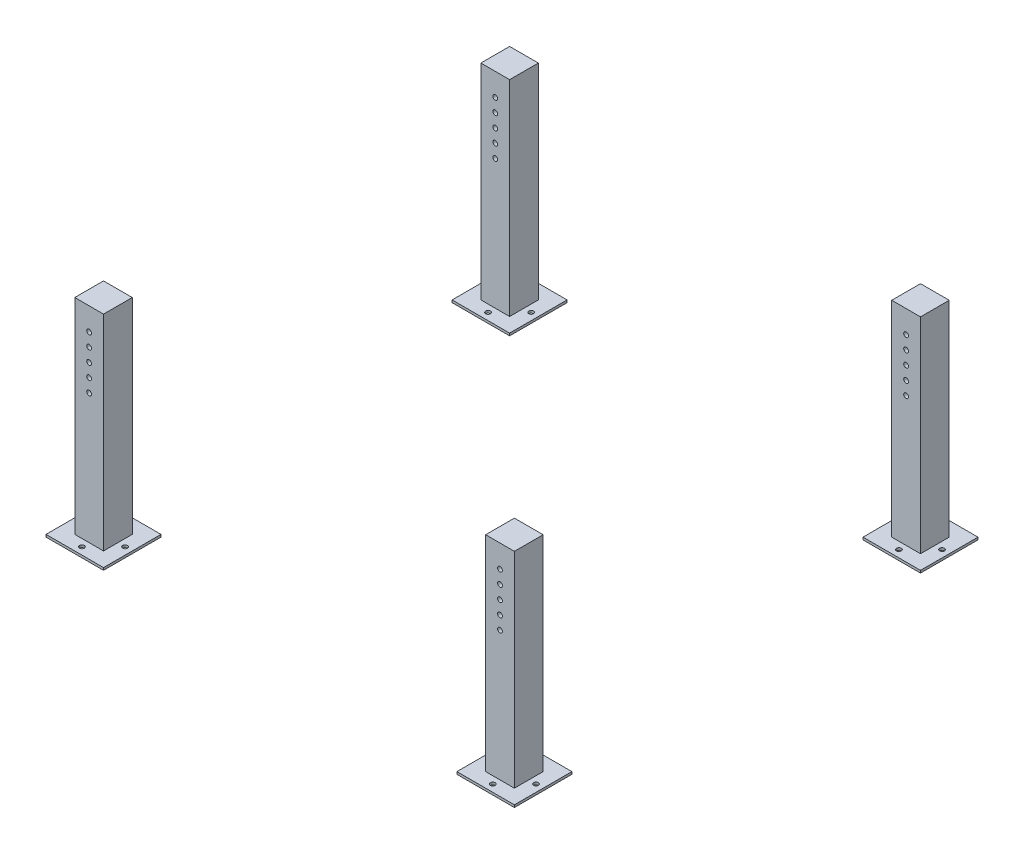
from build123d import *

# Parameters (mm, degrees)
CROQUIS1_W                = 76.2
CROQUIS1_H                = 76.2
SALIENTE_EXTRUIR1_DEPTH   = 550
SALIENTE_EXTRUIR1_2_DEPTH = 550
SALIENTE_EXTRUIR1_3_DEPTH = 550
SALIENTE_EXTRUIR1_4_DEPTH = 550
CROQUIS2_W                = 152.4
CROQUIS2_H                = 152.4
CROQUIS2_W_2              = 76.2
CROQUIS2_H_2              = 76.2
SALIENTE_EXTRUIR2_DEPTH   = 6.35
CROQUIS3_R                = 6.35
CORTAR_EXTRUIR1_DEPTH     = 6.35
CROQUIS4_R                = 6.35
CORTAR_EXTRUIR2_DEPTH     = 6.35
CROQUIS5_R                = 6.35
CORTAR_EXTRUIR3_DEPTH     = 6.35
CROQUIS6_R                = 6.35
CORTAR_EXTRUIR4_DEPTH     = 6.35
CROQUIS7_R                = 6.35
CORTAR_EXTRUIR5_DEPTH     = 76.2
CROQUIS8_R                = 6.35
CORTAR_EXTRUIR6_DEPTH     = 76.2
CORTAR_EXTRUIR7_START     = -76.2
CROQUIS9_R                = 6.35
CORTAR_EXTRUIR7_DEPTH     = 76.2
CORTAR_EXTRUIR8_START     = -76.2
CROQUIS10_R               = 6.35
CORTAR_EXTRUIR8_DEPTH     = 76.2


with BuildPart() as part:
    # Croquis1 → Saliente-Extruir1 (new body)
    with BuildSketch(Plane(origin=(0, 0, 0), x_dir=(1, 0, 0), z_dir=(0, 1, 0))):
        with Locations((38.1, -38.1)):
            Rectangle(CROQUIS1_W, CROQUIS1_H)
    extrude(amount=SALIENTE_EXTRUIR1_DEPTH)



with BuildPart() as body_2:
    # Croquis1 → Saliente-Extruir1 2 (new body)
    with BuildSketch(Plane(origin=(0, 0, 0), x_dir=(1, 0, 0), z_dir=(0, 1, 0))):
        with Locations((1126.97, -38.1)):
            Rectangle(CROQUIS1_W, CROQUIS1_H)
    extrude(amount=SALIENTE_EXTRUIR1_2_DEPTH)


with BuildPart() as body_3:
    # Croquis1 → Saliente-Extruir1 3 (new body)
    with BuildSketch(Plane(origin=(0, 0, 0), x_dir=(1, 0, 0), z_dir=(0, 1, 0))):
        with Locations((1126.97, -1114.3)):
            Rectangle(CROQUIS1_W, CROQUIS1_H)
    extrude(amount=SALIENTE_EXTRUIR1_3_DEPTH)


with BuildPart() as body_4:
    # Croquis1 → Saliente-Extruir1 4 (new body)
    with BuildSketch(Plane(origin=(0, 0, 0), x_dir=(1, 0, 0), z_dir=(0, 1, 0))):
        with Locations((38.1, -1114.3)):
            Rectangle(CROQUIS1_W, CROQUIS1_H)
    extrude(amount=SALIENTE_EXTRUIR1_4_DEPTH)


with BuildPart() as part_1:
    add(part.part)

    add(body_2.part)  # Saliente-Extruir2 merges body 2

    add(body_3.part)  # Saliente-Extruir2 merges body 3

    add(body_4.part)  # Saliente-Extruir2 merges body 4
    # Croquis2 → Saliente-Extruir2 (add)
    # profile 1 of 4: a face of its own
    with BuildSketch(Plane.XZ):
        with Locations((38.1, 38.1)):
            Rectangle(CROQUIS2_W, CROQUIS2_H)
        with Locations((38.1, 38.1)):
            Rectangle(CROQUIS2_W_2, CROQUIS2_H_2, mode=Mode.SUBTRACT)
    # profile 2 of 4: a face of its own
    with BuildSketch(Plane.XZ):
        with Locations((1126.97, 38.1)):
            Rectangle(CROQUIS2_W, CROQUIS2_H)
        with Locations((1126.97, 38.1)):
            Rectangle(CROQUIS2_W_2, CROQUIS2_H_2, mode=Mode.SUBTRACT)
    # profile 3 of 4: a face of its own
    with BuildSketch(Plane.XZ):
        with Locations((1126.97, 1114.3)):
            Rectangle(CROQUIS2_W, CROQUIS2_H)
        with Locations((1126.97, 1114.3)):
            Rectangle(CROQUIS2_W_2, CROQUIS2_H_2, mode=Mode.SUBTRACT)
    # profile 4 of 4: a face of its own
    with BuildSketch(Plane.XZ):
        with Locations((38.1, 1114.3)):
            Rectangle(CROQUIS2_W, CROQUIS2_H)
        with Locations((38.1, 1114.3)):
            Rectangle(CROQUIS2_W_2, CROQUIS2_H_2, mode=Mode.SUBTRACT)
    extrude(amount=-SALIENTE_EXTRUIR2_DEPTH)

    # Croquis3 → Cortar-Extruir1 (cut)
    with BuildSketch(Plane(origin=(0, 6.35, 0), x_dir=(1, 0, 0), z_dir=(0, 1, 0))):
        with Locations(Location((38.1, 19.05, 0), (0, 0, 270))):
            Circle(CROQUIS3_R)
        with Locations(Location((-19.05, -38.1, 0), (0, 0, 90))):
            Circle(CROQUIS3_R)
        with Locations(Location((38.1, -95.25, 0), (0, 0, 90))):
            Circle(CROQUIS3_R)
        with Locations(Location((95.25, -38.1, 0), (0, 0, 270))):
            Circle(CROQUIS3_R)
    extrude(amount=-CORTAR_EXTRUIR1_DEPTH, mode=Mode.SUBTRACT)

    # Croquis4 → Cortar-Extruir2 (cut)
    with BuildSketch(Plane(origin=(0, 6.35, 0), x_dir=(1, 0, 0), z_dir=(0, 1, 0))):
        with Locations(Location((1126.97, 19.05, 0), (0, 0, 270))):
            Circle(CROQUIS4_R)
        with Locations(Location((1069.82, -38.1, 0), (0, 0, 90))):
            Circle(CROQUIS4_R)
        with Locations(Location((1126.97, -95.25, 0), (0, 0, 90))):
            Circle(CROQUIS4_R)
        with Locations(Location((1184.12, -38.1, 0), (0, 0, 270))):
            Circle(CROQUIS4_R)
    extrude(amount=-CORTAR_EXTRUIR2_DEPTH, mode=Mode.SUBTRACT)

    # Croquis5 → Cortar-Extruir3 (cut)
    with BuildSketch(Plane(origin=(0, 6.35, 0), x_dir=(1, 0, 0), z_dir=(0, 1, 0))):
        with Locations(Location((1126.97, -1057.15, 0), (0, 0, 270))):
            Circle(CROQUIS5_R)
        with Locations(Location((1069.82, -1114.3, 0), (0, 0, 90))):
            Circle(CROQUIS5_R)
        with Locations(Location((1126.97, -1171.45, 0), (0, 0, 90))):
            Circle(CROQUIS5_R)
        with Locations(Location((1184.12, -1114.3, 0), (0, 0, 270))):
            Circle(CROQUIS5_R)
    extrude(amount=-CORTAR_EXTRUIR3_DEPTH, mode=Mode.SUBTRACT)

    # Croquis6 → Cortar-Extruir4 (cut)
    with BuildSketch(Plane(origin=(0, 6.35, 0), x_dir=(1, 0, 0), z_dir=(0, 1, 0))):
        with Locations(Location((38.1, -1057.15, 0), (0, 0, 270))):
            Circle(CROQUIS6_R)
        with Locations(Location((-19.05, -1114.3, 0), (0, 0, 90))):
            Circle(CROQUIS6_R)
        with Locations(Location((38.1, -1171.45, 0), (0, 0, 90))):
            Circle(CROQUIS6_R)
        with Locations(Location((95.25, -1114.3, 0), (0, 0, 270))):
            Circle(CROQUIS6_R)
    extrude(amount=-CORTAR_EXTRUIR4_DEPTH, mode=Mode.SUBTRACT)

    # Croquis7 → Cortar-Extruir5 (cut)
    with BuildSketch(Plane.XY.offset(1152.4)):
        with Locations((38.1, 490)):
            Circle(CROQUIS7_R)
        with Locations((38.1, 455)):
            Circle(CROQUIS7_R)
        with Locations((38.1, 420)):
            Circle(CROQUIS7_R)
        with Locations((38.1, 385)):
            Circle(CROQUIS7_R)
        with Locations((38.1, 350)):
            Circle(CROQUIS7_R)
    extrude(amount=-CORTAR_EXTRUIR5_DEPTH, mode=Mode.SUBTRACT)

    # Croquis8 → Cortar-Extruir6 (cut)
    with BuildSketch(Plane.XY.offset(1152.4)):
        with Locations((1126.97, 490)):
            Circle(CROQUIS8_R)
        with Locations((1126.97, 455)):
            Circle(CROQUIS8_R)
        with Locations((1126.97, 420)):
            Circle(CROQUIS8_R)
        with Locations((1126.97, 385)):
            Circle(CROQUIS8_R)
        with Locations((1126.97, 350)):
            Circle(CROQUIS8_R)
    extrude(amount=-CORTAR_EXTRUIR6_DEPTH, mode=Mode.SUBTRACT)

    # Croquis9 → Cortar-Extruir7 (cut)
    with BuildSketch(Plane(origin=(0, 0, 0), x_dir=(-1, 0, 0), z_dir=(0, 0, -1)).offset(CORTAR_EXTRUIR7_START)):
        with Locations(Location((-1126.97, 490, 0), (0, 0, 180))):
            Circle(CROQUIS9_R)
        with Locations(Location((-1126.97, 455, 0), (0, 0, 180))):
            Circle(CROQUIS9_R)
        with Locations(Location((-1126.97, 420, 0), (0, 0, 180))):
            Circle(CROQUIS9_R)
        with Locations(Location((-1126.97, 385, 0), (0, 0, 180))):
            Circle(CROQUIS9_R)
        with Locations(Location((-1126.97, 350, 0), (0, 0, 180))):
            Circle(CROQUIS9_R)
    extrude(amount=CORTAR_EXTRUIR7_DEPTH, mode=Mode.SUBTRACT)

    # Croquis10 → Cortar-Extruir8 (cut)
    with BuildSketch(Plane(origin=(0, 0, 0), x_dir=(-1, 0, 0), z_dir=(0, 0, -1)).offset(CORTAR_EXTRUIR8_START)):
        with Locations(Location((-38.1, 490, 0), (0, 0, 180))):
            Circle(CROQUIS10_R)
        with Locations(Location((-38.1, 455, 0), (0, 0, 180))):
            Circle(CROQUIS10_R)
        with Locations(Location((-38.1, 420, 0), (0, 0, 180))):
            Circle(CROQUIS10_R)
        with Locations(Location((-38.1, 385, 0), (0, 0, 180))):
            Circle(CROQUIS10_R)
        with Locations(Location((-38.1, 350, 0), (0, 0, 180))):
            Circle(CROQUIS10_R)
    extrude(amount=CORTAR_EXTRUIR8_DEPTH, mode=Mode.SUBTRACT)


solid = part_1.part
